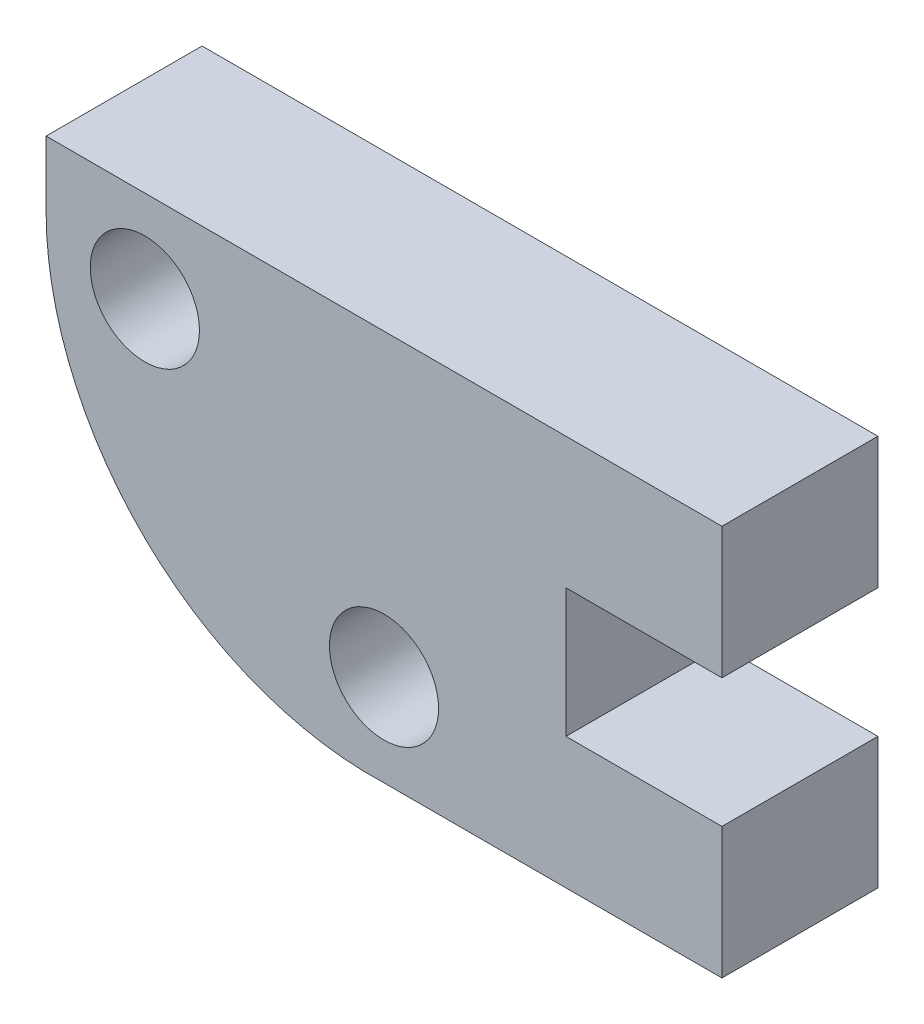
from build123d import *

# Parameters (mm, degrees)
ESQUISSE1_R        = 2.1
BOSS_EXTRU_1_DEPTH = 6


with BuildPart() as part:
    # Esquisse1 → Boss.-Extru.1 (new body)
    with BuildSketch(Plane.XY):
        with BuildLine():
            Line((0, 0), (0, -5.05))
            Line((0, -5.05), (-6, -5.05))
            Line((-6, -5.05), (-6, -10))
            Line((-6, -10), (0, -10))
            Line((0, -10), (0, -15.05))
            Line((0, -15.05), (-13, -15.05))
            ThreePointArc((-13, -15.05), (-22.164162355, -11.534690089), (-26, -2.5))
            Line((-26, -2.5), (-26, 0))
            Line((-26, 0), (0, 0))
        make_face()
        with Locations((-22.2, -3.525)):
            Circle(ESQUISSE1_R, mode=Mode.SUBTRACT)
        with Locations((-13, -11.525)):
            Circle(ESQUISSE1_R, mode=Mode.SUBTRACT)
    extrude(amount=BOSS_EXTRU_1_DEPTH)


solid = part.part
